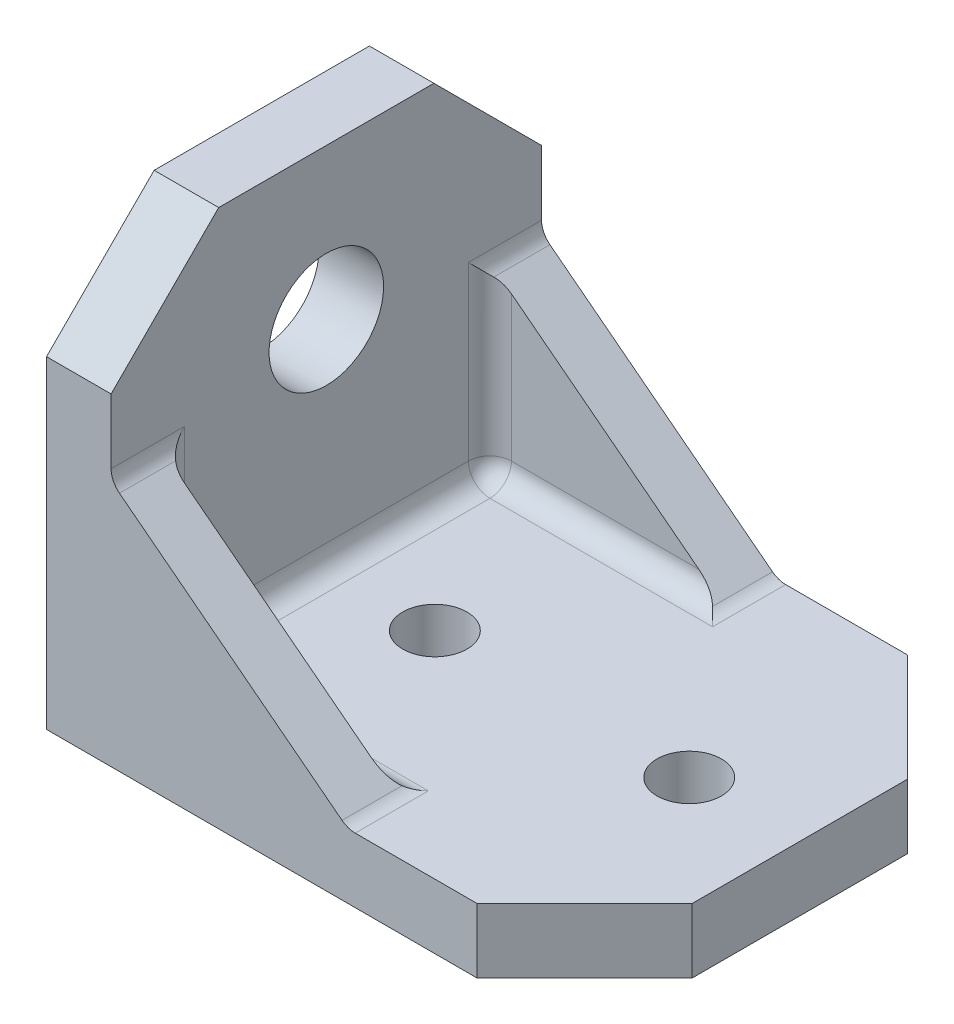
from build123d import *

# Parameters (mm, degrees)
BOSS_EXTRUDE1_DEPTH     = 25.4
F_6_CLEARANCE_HOLE1_D   = 3.7973
F_1_4_CLEARANCE_HOLE1_D = 6.7564
BOSS_EXTRUDE2_DEPTH     = 3.048
BOSS_EXTRUDE3_DEPTH     = 3.048
FILLET1_R               = 1.27
CHAMFER1_SIZE           = 6.35


with BuildPart() as part:
    # Sketch1 → Boss-Extrude1 (new body)
    with BuildSketch(Plane.XY):
        Polygon((0, 0), (0, 25.4), (3.81, 25.4), (3.81, 3.81), (31.75, 3.81), (31.75, 0), align=None)
    extrude(amount=BOSS_EXTRUDE1_DEPTH)

    # #6 Clearance Hole1 (through all)
    with Locations(Plane(origin=(0, 3.81, 0), x_dir=(1, 0, 0), z_dir=(0, 1, 0))):
        with Locations((10.2108, -12.7), (25.2222, -12.7)):
            Hole(F_6_CLEARANCE_HOLE1_D / 2)

    # 1/4 Clearance Hole1 (through all)
    with Locations(Plane(origin=(3.81, 0, 0), x_dir=(0, 0, -1), z_dir=(1, 0, 0))):
        with Locations((-12.7, 16.51)):
            Hole(F_1_4_CLEARANCE_HOLE1_D / 2)

    # Sketch6 → Boss-Extrude2 (add)
    with BuildSketch(Plane.XY.offset(25.4)):
        Polygon((3.81, 3.81), (17.78, 3.81), (3.81, 14.605), align=None)
    extrude(amount=-BOSS_EXTRUDE2_DEPTH)

    # Sketch7 → Boss-Extrude3 (add)
    with BuildSketch(Plane(origin=(0, 0, 0), x_dir=(-1, 0, 0), z_dir=(0, 0, -1))):
        Polygon((-3.81, 3.81), (-17.78, 3.81), (-3.81, 14.605), align=None)
    extrude(amount=-BOSS_EXTRUDE3_DEPTH)

    # Fillet1
    fillet1_edges = [part.edges().sort_by_distance(p)[0] for p in [
        (3.81, 3.81, 12.7),
        (3.81, 9.2075, 22.352),
        (3.81, 14.605, 23.876),
        (10.795, 3.81, 22.352),
        (17.78, 3.81, 23.876),
        (3.81, 9.2075, 3.048),
        (3.81, 14.605, 1.524),
        (10.795, 3.81, 3.048),
        (17.78, 3.81, 1.524),
    ]]
    fillet(fillet1_edges, radius=FILLET1_R)

    # Chamfer1
    chamfer1_edges = [part.edges().sort_by_distance(p)[0] for p in [
        (1.905, 25.4, 25.4),
        (1.905, 25.4, 0),
        (31.75, 1.905, 0),
        (31.75, 1.905, 25.4),
    ]]
    chamfer(chamfer1_edges, length=CHAMFER1_SIZE)


solid = part.part
